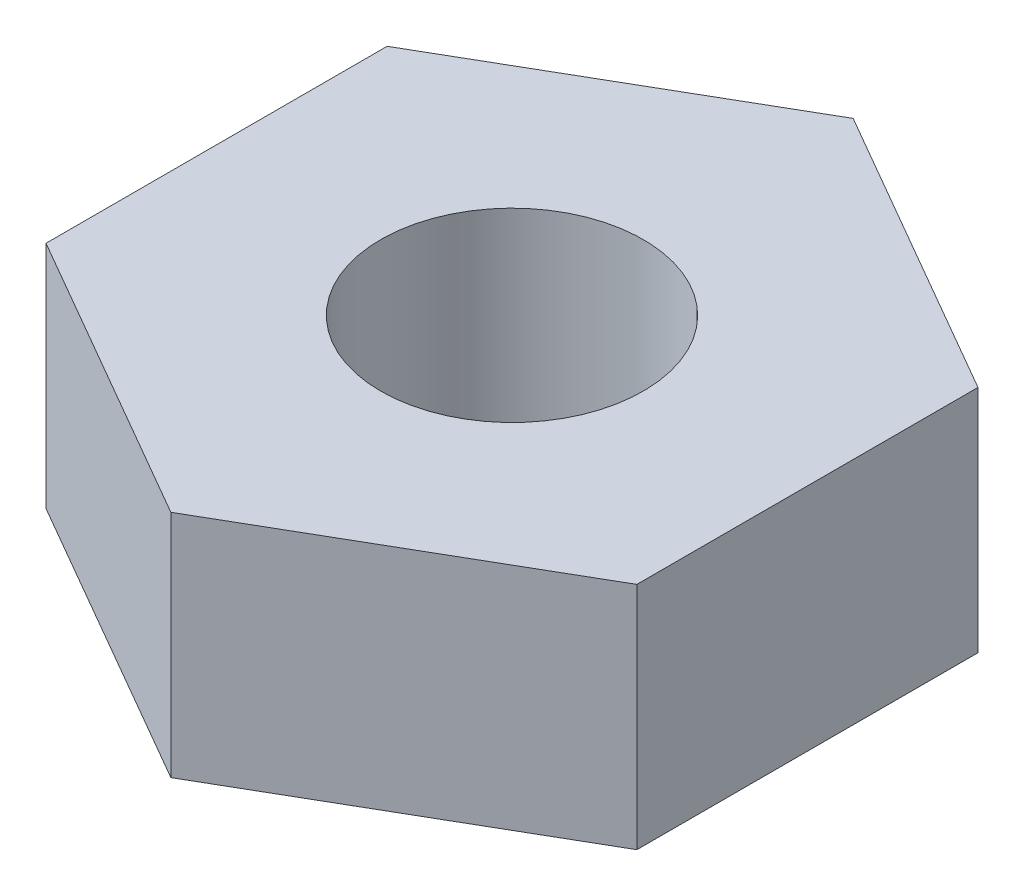
from build123d import *

# Parameters (mm, degrees)
SKETCH1_R           = 1
BOSS_EXTRUDE1_DEPTH = 1.75


with BuildPart() as part:
    # Sketch1 → Boss-Extrude1 (new body)
    with BuildSketch(Plane(origin=(0, 0, 0), x_dir=(1, 0, 0), z_dir=(0, 1, 0))):
        Polygon((0, 2.598076211), (-2.25, 1.299038106), (-2.25, -1.299038106), (0, -2.598076211), (2.25, -1.299038106), (2.25, 1.299038106), align=None)
        with Locations(Location((0, 0, 0), (0, 0, 270))):
            Circle(SKETCH1_R, mode=Mode.SUBTRACT)
    extrude(amount=BOSS_EXTRUDE1_DEPTH)


solid = part.part
